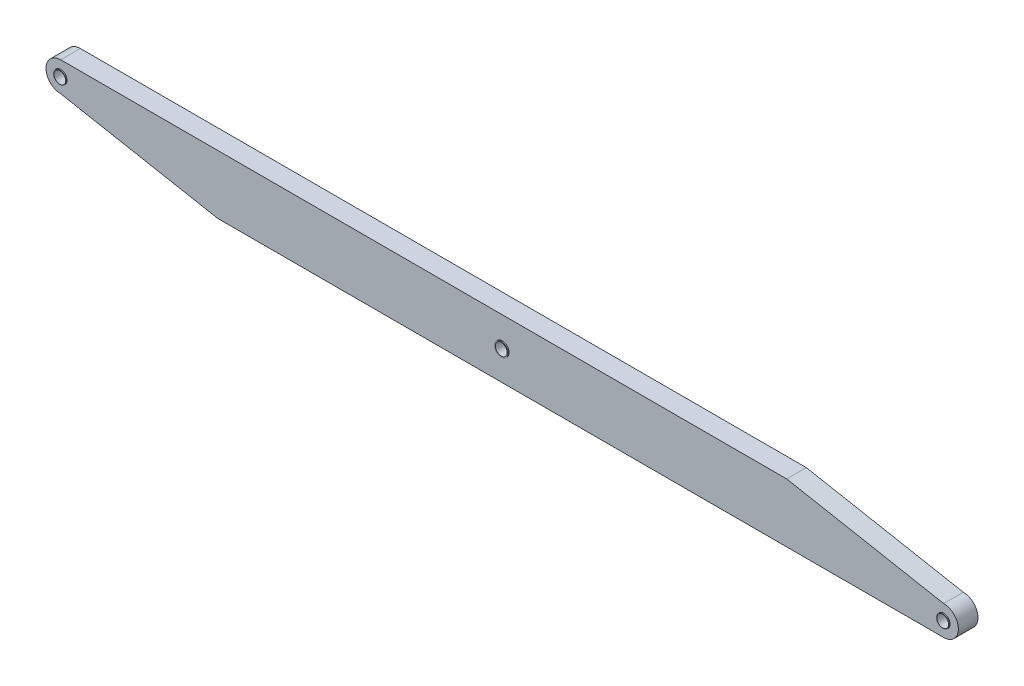
from build123d import *

# Parameters (mm, degrees)
EXTRUDE_1_DEPTH     = 100
SKETCH_2_R          = 30
CUT_EXTRUDE_1_DEPTH = 100
SKETCH_3_R          = 32.5
SKETCH_3_R_2        = 30
EXTRUDE_2_DEPTH     = 5
EXTRUDE_START       = 5
SKETCH_4_R          = 32.5
SKETCH_4_R_2        = 30
EXTRUDE_3_DEPTH     = 5
SKETCH_5_R          = 30
CUT_EXTRUDE_2_DEPTH = 248
SKETCH_6_R          = 35
SKETCH_6_R_2        = 30
EXTRUDE_4_DEPTH     = 5
SKETCH_7_R          = 35
SKETCH_7_R_2        = 30
EXTRUDE_5_DEPTH     = 5
SCALE1_SCALE        = 0.345


with BuildPart() as part:
    # 草图1 → 凸台-拉伸1 (new body)
    with BuildSketch(Plane.XY):
        with BuildLine():
            Line((-60.1323511, -127.533248731), (739.8676489, -277.533248731))
            Line((739.8676489, -277.533248731), (4439.8676489, -277.533248731))
            ThreePointArc((4439.8676489, -277.533248731), (4514.8676489, -202.533248731), (4439.8676489, -127.533248731))
            Line((4439.8676489, -127.533248731), (3639.8676489, 22.466751269))
            Line((3639.8676489, 22.466751269), (-60.1323511, 22.466751269))
            ThreePointArc((-60.1323511, 22.466751269), (-135.1323511, -52.533248731), (-60.1323511, -127.533248731))
        make_face()
    extrude(amount=EXTRUDE_1_DEPTH)

    # 草图2 → 切除-拉伸1 (cut)
    with BuildSketch(Plane.XY.offset(100)):
        with Locations((-60.1323511, -52.533248731)):
            Circle(SKETCH_2_R)
        with Locations((4439.8676489, -202.533248731)):
            Circle(SKETCH_2_R)
    extrude(amount=-CUT_EXTRUDE_1_DEPTH, mode=Mode.SUBTRACT)

    # 草图3 → 凸台-拉伸2 (add)
    # profile 1 of 2: a face of its own
    with BuildSketch(Plane(origin=(0, 0, 0), x_dir=(-1, 0, 0), z_dir=(0, 0, -1))):
        with Locations(Location((-4439.8676489, -202.533248731, 0), (0, 0, 180))):
            Circle(SKETCH_3_R)
        with Locations(Location((-4439.8676489, -202.533248731, 0), (0, 0, 180))):
            Circle(SKETCH_3_R_2, mode=Mode.SUBTRACT)
    # profile 2 of 2: a face of its own
    with BuildSketch(Plane(origin=(0, 0, 0), x_dir=(-1, 0, 0), z_dir=(0, 0, -1))):
        with Locations(Location((60.1323511, -52.533248731, 0), (0, 0, 180))):
            Circle(SKETCH_3_R)
        with Locations(Location((60.1323511, -52.533248731, 0), (0, 0, 180))):
            Circle(SKETCH_3_R_2, mode=Mode.SUBTRACT)
    extrude(amount=EXTRUDE_2_DEPTH)

    # 草图4 → 凸台-拉伸3 (add)
    # profile 1 of 2: a face of its own
    with BuildSketch(Plane.XY.offset(100).offset(EXTRUDE_START)):
        with Locations((-60.1323511, -52.533248731)):
            Circle(SKETCH_4_R)
        with Locations((-60.1323511, -52.533248731)):
            Circle(SKETCH_4_R_2, mode=Mode.SUBTRACT)
    # profile 2 of 2: a face of its own
    with BuildSketch(Plane.XY.offset(100).offset(EXTRUDE_START)):
        with Locations((4439.8676489, -202.533248731)):
            Circle(SKETCH_4_R)
        with Locations((4439.8676489, -202.533248731)):
            Circle(SKETCH_4_R_2, mode=Mode.SUBTRACT)
    extrude(amount=-EXTRUDE_3_DEPTH)

    # 草图5 → 切除-拉伸2 (cut)
    with BuildSketch(Plane(origin=(0, 0, 0), x_dir=(-1, 0, 0), z_dir=(0, 0, -1))):
        with Locations((-2189.8676489, -127.533248731)):
            Circle(SKETCH_5_R)
    extrude(amount=-CUT_EXTRUDE_2_DEPTH, mode=Mode.SUBTRACT)

    # 草图6 → 凸台-拉伸4 (add)
    with BuildSketch(Plane(origin=(0, 0, 0), x_dir=(-1, 0, 0), z_dir=(0, 0, -1)).offset(EXTRUDE_START)):
        with Locations(Location((-2189.8676489, -127.533248731, 0), (0, 0, 180))):
            Circle(SKETCH_6_R)
        with Locations((-2189.8676489, -127.533248731)):
            Circle(SKETCH_6_R_2, mode=Mode.SUBTRACT)
    extrude(amount=-EXTRUDE_4_DEPTH)

    # 草图7 → 凸台-拉伸5 (add)
    with BuildSketch(Plane.XY.offset(100)):
        with Locations((2189.8676489, -127.533248731)):
            Circle(SKETCH_7_R)
        with Locations(Location((2189.8676489, -127.533248731, 0), (0, 0, 180))):
            Circle(SKETCH_7_R_2, mode=Mode.SUBTRACT)
    extrude(amount=EXTRUDE_5_DEPTH)


with BuildPart() as part_1:
    # Scale1: scaled about (2189.8676489, -127.533248731, 50)
    add(part.part.scale(SCALE1_SCALE).moved(Location((1434.36331003, -83.534277919, 32.75))))


solid = part_1.part
